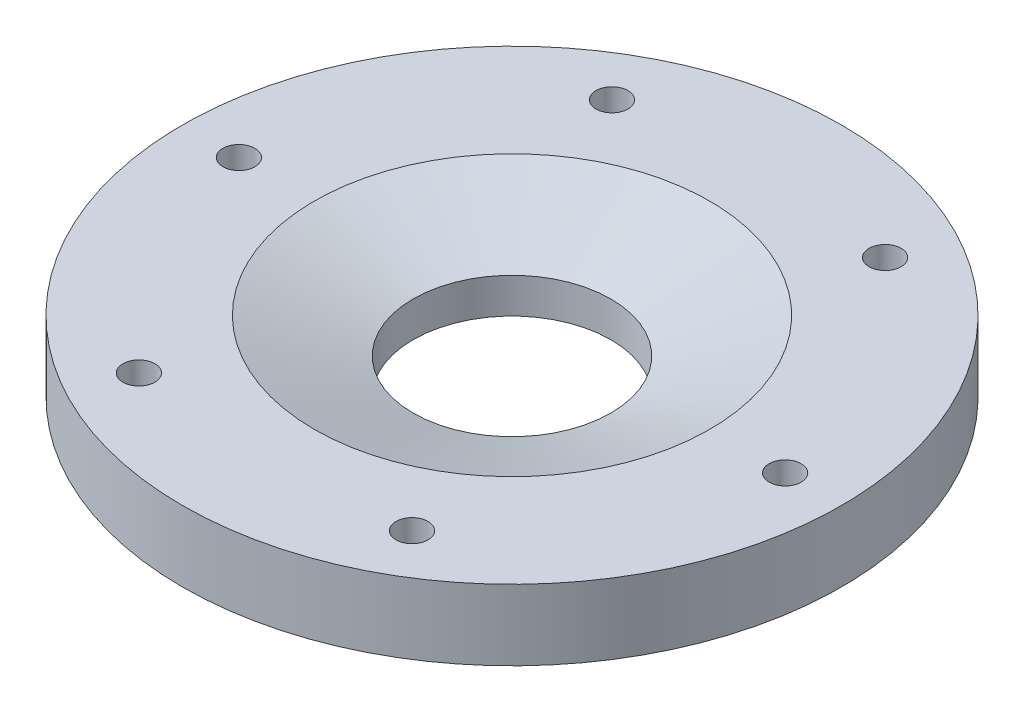
from build123d import *

# Parameters (mm, degrees)
OTW_R_GWINTOWANY_M81_D = 6.8


with BuildPart() as part:
    # Szkic1 → Obrót1 (revolve)
    with BuildSketch(Plane.XY, mode=Mode.PRIVATE) as obr_t1_sk:
        Polygon((-70, 9.103065775), (-70, -5.896934225), (-21, -5.896934225), (-21, 1.603065775), (-42, 9.103065775), align=None)
    revolve(obr_t1_sk.sketch.rotate(Axis((0, 48.980657748, 0), (0, -1, 0)), 270), axis=Axis((0, 48.980657748, 0), (0, -1, 0)))

    # Otwór gwintowany M81 (through all)
    with Locations(Plane(origin=(0, 9.103065775, 0), x_dir=(1, 0, 0), z_dir=(0, 1, 0))):
        with Locations((-58.015165068, 0), (-29.007582534, 50.242606754), (29.007582534, 50.242606754), (58.015165068, 0), (29.007582534, -50.242606754), (-29.007582534, -50.242606754)):
            Hole(OTW_R_GWINTOWANY_M81_D / 2)


solid = part.part
